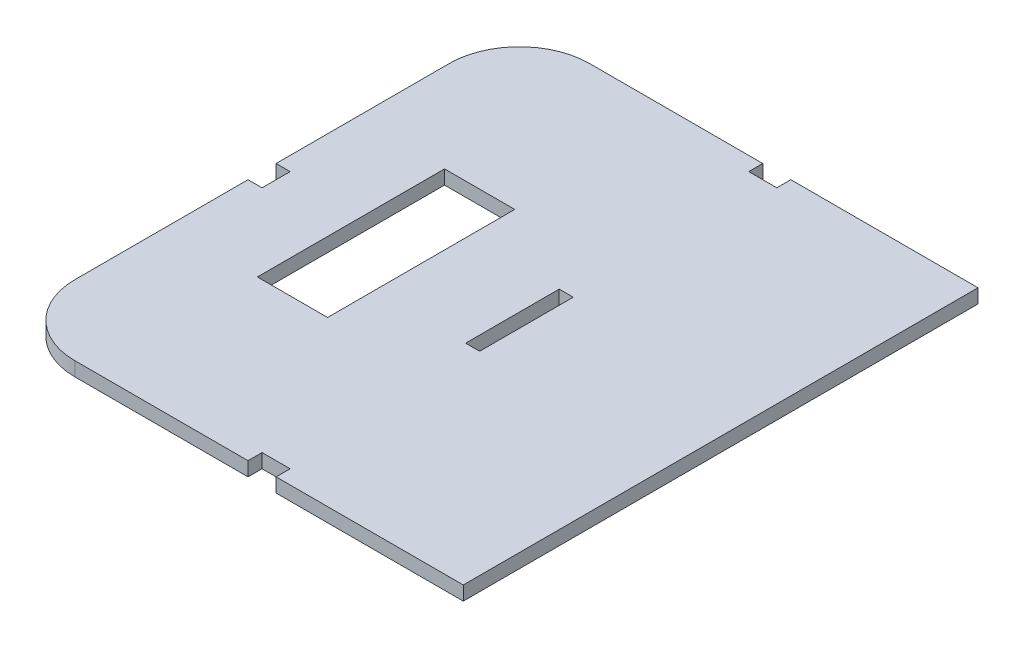
from build123d import *

# Parameters (mm, degrees)
EXTRUDE_3_DEPTH    = 3
SKETCH1_W          = 15
SKETCH1_H          = 40
SKETCH1_W_2        = 3
SKETCH1_H_2        = 20
CUT_EXTRUDE1_DEPTH = 10
FILLET1_R          = 15


with BuildPart() as part:
    # Эскиз4 → Бобышка-Вытянуть3 (new body)
    with BuildSketch(Plane(origin=(0, 0, 0), x_dir=(1, 0, 0), z_dir=(0, 1, 0))):
        Polygon((98, 0), (98, 110), (58, 110), (58, 107), (55, 107), (52, 107), (52, 110), (0, 110), (0, 58), (3, 58), (3, 55), (3, 52), (0, 52), (0, 0), (52, 0), (52, 3), (55, 3), (58, 3), (58, 0), align=None)
    extrude(amount=EXTRUDE_3_DEPTH)

    # Sketch1 → Cut-Extrude1 (cut)
    with BuildSketch(Plane(origin=(0, 3, 0), x_dir=(1, 0, 0), z_dir=(0, 1, 0))):
        with Locations((26.5, 55)):
            Rectangle(SKETCH1_W, SKETCH1_H)
        with Locations((55, 55)):
            Rectangle(SKETCH1_W_2, SKETCH1_H_2)
    extrude(amount=-CUT_EXTRUDE1_DEPTH, mode=Mode.SUBTRACT)

    # Fillet1
    fillet1_edges = [part.edges().sort_by_distance(p)[0] for p in [
        (0, 1.5, 0),
        (0, 1.5, -110),
    ]]
    fillet(fillet1_edges, radius=FILLET1_R)


solid = part.part
